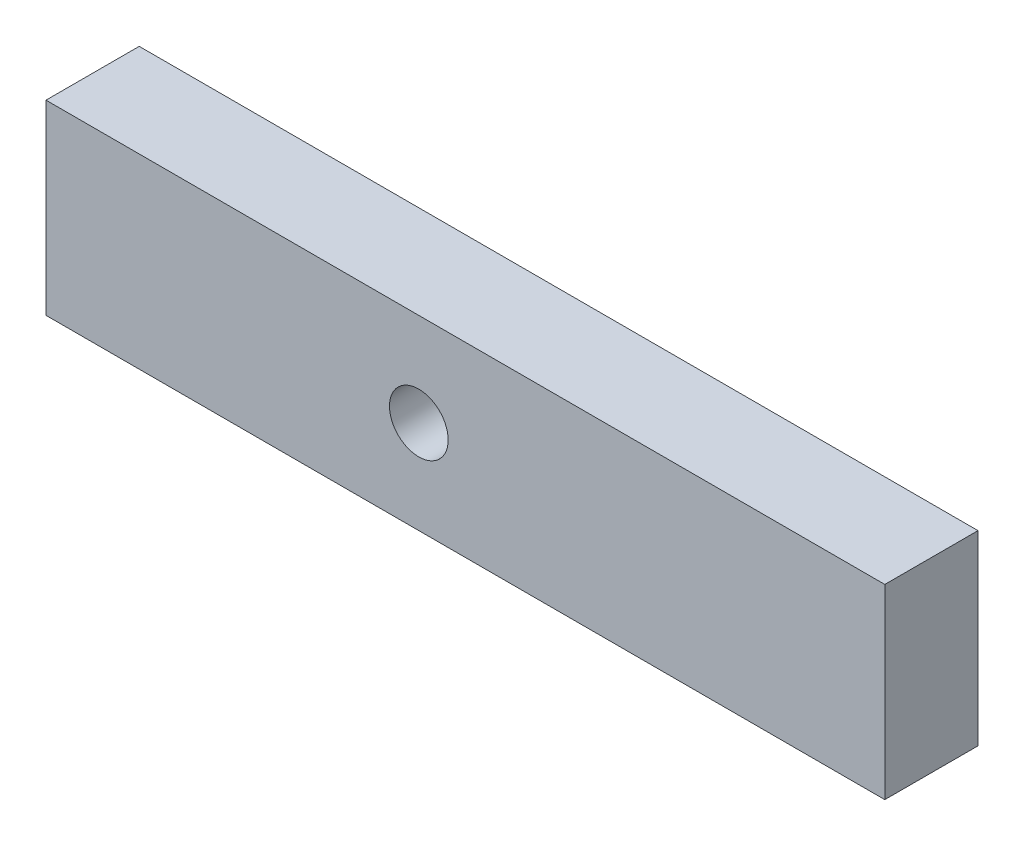
from build123d import *

# Parameters (mm, degrees)
SKETCH1_W           = 114.3
SKETCH1_H           = 25.4
SKETCH1_R           = 4
BOSS_EXTRUDE1_DEPTH = 12.7


with BuildPart() as part:
    # Sketch1 → Boss-Extrude1 (new body)
    with BuildSketch(Plane.XY):
        with Locations((57.15, 12.7)):
            Rectangle(SKETCH1_W, SKETCH1_H)
        with Locations((50.8, 12.7)):
            Circle(SKETCH1_R, mode=Mode.SUBTRACT)
    extrude(amount=BOSS_EXTRUDE1_DEPTH)


solid = part.part
